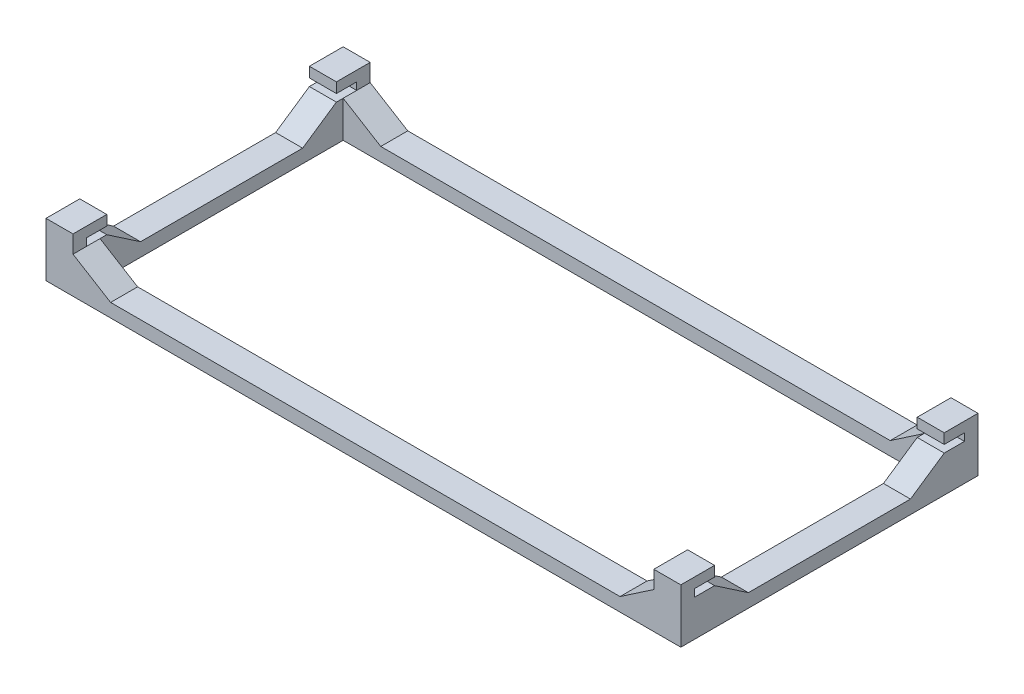
from build123d import *

# Parameters (mm, degrees)
SKETCH_1_W       = 94
SKETCH_1_H       = 44
SKETCH_1_W_2     = 86
SKETCH_1_H_2     = 36
EXTRUDE_2_DEPTH  = 2
EXTRUDE_3_DEPTH  = 4
EXTRUDE_4_DEPTH  = 4
EXTRUDE_5_DEPTH  = 4
EXTRUDE_6_DEPTH  = 4
EXTRUDE_7_DEPTH  = 4
EXTRUDE_8_DEPTH  = 4
EXTRUDE_9_DEPTH  = 4
EXTRUDE_10_DEPTH = 4


with BuildPart() as part:
    # Эскиз1 → Бобышка-Вытянуть2 (new body)
    with BuildSketch(Plane(origin=(0, 0, 0), x_dir=(1, 0, 0), z_dir=(0, 1, 0))):
        Rectangle(SKETCH_1_W, SKETCH_1_H)
        Rectangle(SKETCH_1_W_2, SKETCH_1_H_2, mode=Mode.SUBTRACT)
    extrude(amount=EXTRUDE_2_DEPTH)

    # Эскиз2 → Бобышка-Вытянуть3 (add)
    with BuildSketch(Plane(origin=(47, 0, 0), x_dir=(0, 0, -1), z_dir=(1, 0, 0))):
        Polygon((-22, 8), (-22, 2), (-17, 2), (-17, 5.4), (-20, 5.4), (-20, 6.5), (-17, 6.5), (-17, 8), align=None)
        Polygon((-17, 5.4), (-17, 2), (-12, 2), align=None)
    extrude(amount=-EXTRUDE_3_DEPTH)

    # Эскиз3 → Бобышка-Вытянуть4 (add)
    with BuildSketch(Plane(origin=(47, 0, 0), x_dir=(0, 0, -1), z_dir=(1, 0, 0))):
        Polygon((17, 2), (22, 2), (22, 8), (17, 8), (17, 6.5), (20, 6.5), (20, 5.4), (17, 5.4), align=None)
        Polygon((12, 2), (17, 2), (17, 5.4), align=None)
    extrude(amount=-EXTRUDE_4_DEPTH)

    # Эскиз4 → Бобышка-Вытянуть5 (add)
    with BuildSketch(Plane.ZY.offset(47)):
        Polygon((-22, 8), (-22, 2), (-17, 2), (-17, 5.4), (-20, 5.4), (-20, 6.5), (-17, 6.5), (-17, 8), align=None)
        Polygon((-17, 5.4), (-17, 2), (-12, 2), align=None)
    extrude(amount=-EXTRUDE_5_DEPTH)

    # Эскиз5 → Бобышка-Вытянуть6 (add)
    with BuildSketch(Plane.ZY.offset(47)):
        Polygon((12, 2), (17, 2), (17, 5.4), align=None)
        Polygon((17, 2), (22, 2), (22, 8), (17, 8), (17, 6.5), (20, 6.5), (20, 5.4), (17, 5.4), align=None)
    extrude(amount=-EXTRUDE_6_DEPTH)

    # Эскиз6 → Бобышка-Вытянуть7 (add)
    with BuildSketch(Plane.XY.offset(22)):
        Polygon((-43, 2), (-43, 5.4), (-37.433571672, 2), align=None)
    extrude(amount=-EXTRUDE_7_DEPTH)

    # Эскиз7 → Бобышка-Вытянуть8 (add)
    with BuildSketch(Plane.XY.offset(22)):
        Polygon((43, 2), (43, 5.4), (38, 2), align=None)
    extrude(amount=-EXTRUDE_8_DEPTH)

    # Эскиз8 → Бобышка-Вытянуть9 (add)
    with BuildSketch(Plane(origin=(0, 0, -22), x_dir=(-1, 0, 0), z_dir=(0, 0, -1))):
        Polygon((-43, 2), (-43, 5.4), (-38, 2), align=None)
    extrude(amount=-EXTRUDE_9_DEPTH)

    # Эскиз9 → Бобышка-Вытянуть10 (add)
    with BuildSketch(Plane(origin=(0, 0, -22), x_dir=(-1, 0, 0), z_dir=(0, 0, -1))):
        Polygon((43, 2), (43, 5.4), (37.433571672, 2), align=None)
    extrude(amount=-EXTRUDE_10_DEPTH)


solid = part.part
